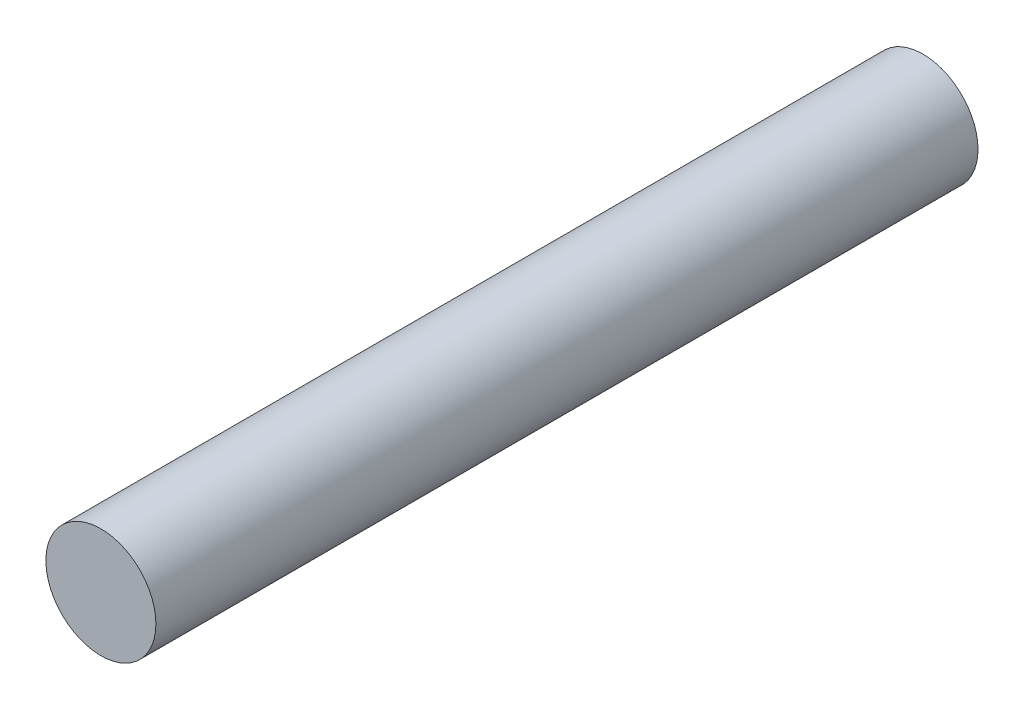
from build123d import *

# Parameters (mm, degrees)
SKETCH_1_R      = 0.95
EXTRUDE_1_DEPTH = 14.2


with BuildPart() as part:
    # 草图1 → 凸台-拉伸1 (new body)
    with BuildSketch(Plane.XY):
        Circle(SKETCH_1_R)
    extrude(amount=EXTRUDE_1_DEPTH)


solid = part.part
